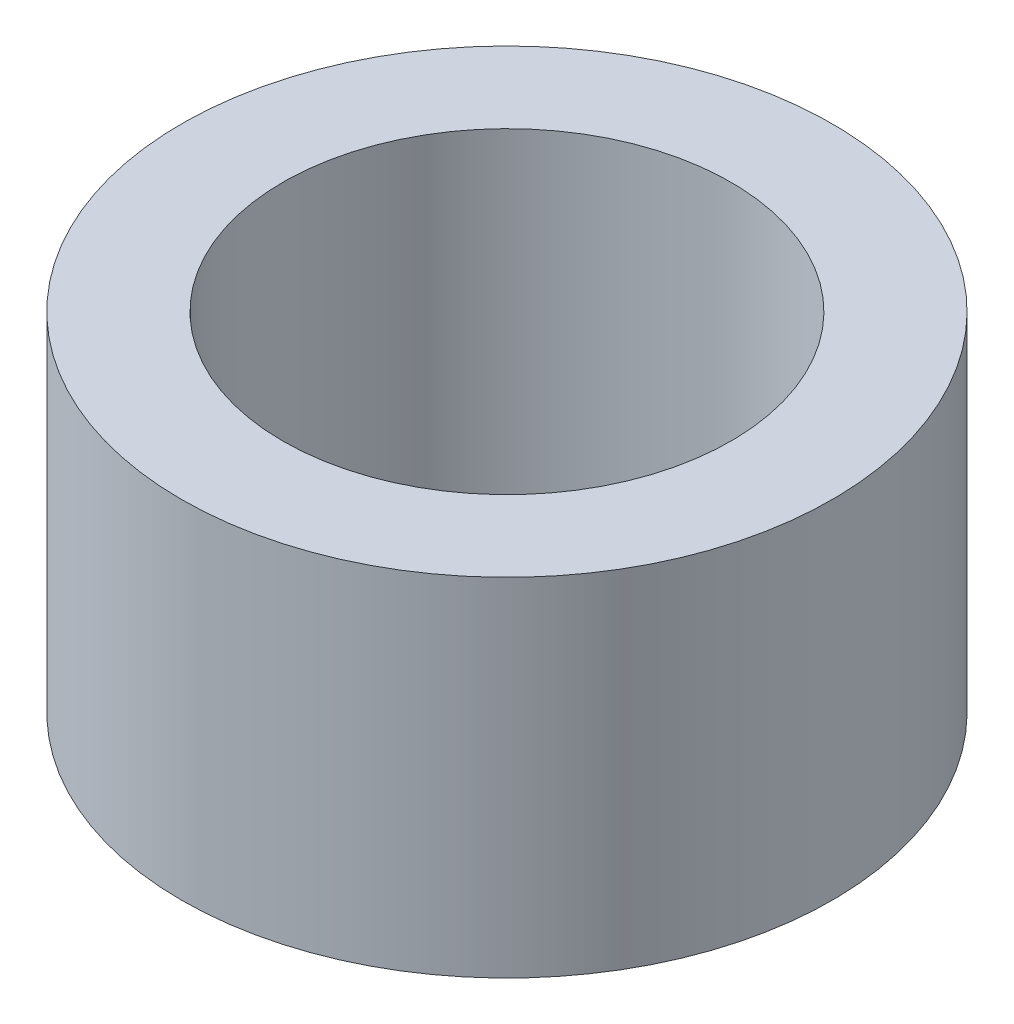
from build123d import *

# Parameters (mm, degrees)
SKETCH_1_R      = 4.5
SKETCH_1_R_2    = 3
EXTRUDE_1_DEPTH = 4.8
MOVE_FACE_1_BY  = 0.1


with BuildPart() as part:
    # ｽｹｯﾁ1 → ﾎﾞｽ - 押し出し1 (new body)
    with BuildSketch(Plane(origin=(0, 0, 0), x_dir=(1, 0, 0), z_dir=(0, 1, 0))):
        with Locations(Location((0, 0, 0), (0, 0, 270))):
            Circle(SKETCH_1_R)
        with Locations(Location((0, 0, 0), (0, 0, 270))):
            Circle(SKETCH_1_R_2, mode=Mode.SUBTRACT)
    extrude(amount=EXTRUDE_1_DEPTH)

    # Move Face 1: a curved face moved inward by 0.1
    add(Solid.thicken(part.faces().sort_by_distance((0, 2.4, -3))[0], -MOVE_FACE_1_BY), mode=Mode.SUBTRACT)


solid = part.part
